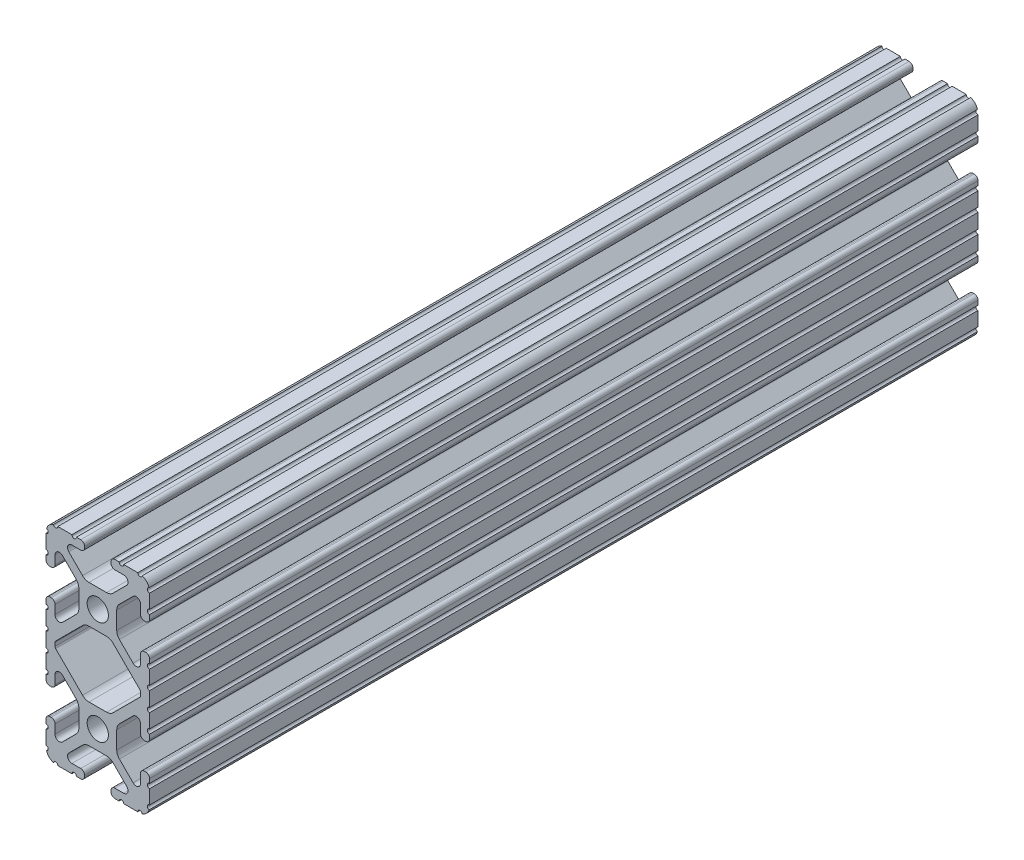
from build123d import *

# Parameters (mm, degrees)
BOSS_EXTRUDE1_DEPTH     = 152.4
CUT_EXTRUDE1_DEPTH      = 156.02325632
CUT_EXTRUDE1_DEPTH_BACK = 156.02325632
SKETCH5_R               = 0.55245
BOSS_EXTRUDE2_DEPTH     = 152.4
CUT_EXTRUDE2_DEPTH      = 156.02325632
CUT_EXTRUDE2_DEPTH_BACK = 156.02325632
SKETCH8_W               = 50.8
SKETCH8_H               = 50.8
CUT_EXTRUDE3_DEPTH      = 157.576115675


with BuildPart() as part:
    # Sketch4 → Boss-Extrude1 (new, symmetric)
    with BuildSketch(Plane.XY):
        with BuildLine():
            Line((4.190365, -25.4), (10.11729625, -25.4))
            ThreePointArc((10.11729625, -25.4), (11.943543585, -24.643543585), (12.7, -22.81729625))
            Line((12.7, -22.81729625), (12.7, -16.890365))
            ThreePointArc((12.7, -16.890365), (12.42492494, -16.22627506), (11.760835, -15.9512))
            Line((11.760835, -15.9512), (11.429365, -15.9512))
            ThreePointArc((11.429365, -15.9512), (10.76527506, -16.22627506), (10.4902, -16.890365))
            Line((10.4902, -16.890365), (10.4902, -19.048478019))
            ThreePointArc((10.4902, -19.048478019), (9.830707141, -20.035478831), (8.666460301, -19.803895736))
            Line((8.666460301, -19.803895736), (5.299899128, -16.437334563))
            ThreePointArc((5.299899128, -16.437334563), (4.817571085, -15.715479634), (4.6482, -14.86399369))
            Line((4.6482, -14.86399369), (4.6482, -12.7))
            Line((4.6482, -12.7), (2.6035, -12.7))
            ThreePointArc((2.6035, -12.7), (1.840952505, -14.540952505), (0, -15.3035))
            Line((0, -15.3035), (0, -17.3482))
            Line((0, -17.3482), (2.16399369, -17.3482))
            ThreePointArc((2.16399369, -17.3482), (3.015479634, -17.517571085), (3.737334563, -17.999899128))
            Line((3.737334563, -17.999899128), (7.103895736, -21.366460301))
            ThreePointArc((7.103895736, -21.366460301), (7.335478831, -22.530707141), (6.348478019, -23.1902))
            Line((6.348478019, -23.1902), (4.190365, -23.1902))
            ThreePointArc((4.190365, -23.1902), (3.52627506, -23.46527506), (3.2512, -24.129365))
            Line((3.2512, -24.129365), (3.2512, -24.460835))
            ThreePointArc((3.2512, -24.460835), (3.52627506, -25.12492494), (4.190365, -25.4))
        make_face()
    extrude(amount=BOSS_EXTRUDE1_DEPTH, both=True)

    # Sketch5 → Cut-Extrude1 (cut, two sides: drawn at the far end of the back side and taken through both)
    with BuildSketch(Plane.XY.offset(-CUT_EXTRUDE1_DEPTH_BACK)):
        with Locations((10.356153152, -25.4)):
            Circle(SKETCH5_R)
        with Locations((5.796028019, -25.4)):
            Circle(SKETCH5_R)
        with Locations((12.7, -23.056153152)):
            Circle(SKETCH5_R)
        with Locations((12.7, -18.496028019)):
            Circle(SKETCH5_R)
    extrude(amount=CUT_EXTRUDE1_DEPTH + CUT_EXTRUDE1_DEPTH_BACK, mode=Mode.SUBTRACT)

    # Mirror1: part across plane


with BuildPart() as part_1:
    add(part.part)
    add(part.part.mirror(Plane(origin=(4.6482, -12.7, 152.4), x_dir=(0, 0, 1), z_dir=(0, -1, 0))))

    # Sketch6 → Boss-Extrude2 (add, symmetric)
    with BuildSketch(Plane.XY):
        with BuildLine():
            Line((12.7, -1.791396848), (12.7, 0))
            Line((12.7, 0), (9.803703152, 0))
            Line((9.803703152, 0), (9.803703152, -2.343846848))
            Line((9.803703152, -2.343846848), (12.14755, -2.343846848))
            ThreePointArc((12.14755, -2.343846848), (12.309358859, -1.953205706), (12.7, -1.791396848))
        make_face()
    extrude(amount=BOSS_EXTRUDE2_DEPTH, both=True)

    # Sketch7 → Cut-Extrude2 (cut, two sides: drawn at the far end of the back side and taken through both)
    with BuildSketch(Plane.XY.offset(-CUT_EXTRUDE2_DEPTH_BACK)):
        with BuildLine():
            Line((5.420615149, -5.716820286), (10.328391141, -0.809044294))
            ThreePointArc((10.328391141, -0.809044294), (10.448147248, -0.629816615), (10.4902, -0.418403152))
            Line((10.4902, -0.418403152), (10.4902, 0))
            Line((10.4902, 0), (0, 0))
            Line((0, 0), (5.420615149, -5.716820286))
        make_face()
    extrude(amount=CUT_EXTRUDE2_DEPTH + CUT_EXTRUDE2_DEPTH_BACK, mode=Mode.SUBTRACT)

    # Mirror2: part across plane


with BuildPart() as part_2:
    add(part_1.part)
    add(part_1.part.mirror(Plane.ZX))

    # Mirror3: part across plane


with BuildPart() as part_3:
    add(part_2.part)
    add(part_2.part.mirror(Plane(origin=(0, 0, 0), x_dir=(0, 0, 1), z_dir=(1, 0, 0))))

    # Sketch8 → Cut-Extrude3 (cut, through all)
    with BuildSketch(Plane(origin=(12.7, 0, 0), x_dir=(0, 0, -1), z_dir=(1, 0, 0))):
        with Locations((-127, 0)):
            Rectangle(SKETCH8_W, SKETCH8_H)
        with Locations((127, 0)):
            Rectangle(SKETCH8_W, SKETCH8_H)
    extrude(amount=-CUT_EXTRUDE3_DEPTH, mode=Mode.SUBTRACT)


solid = part_3.part
